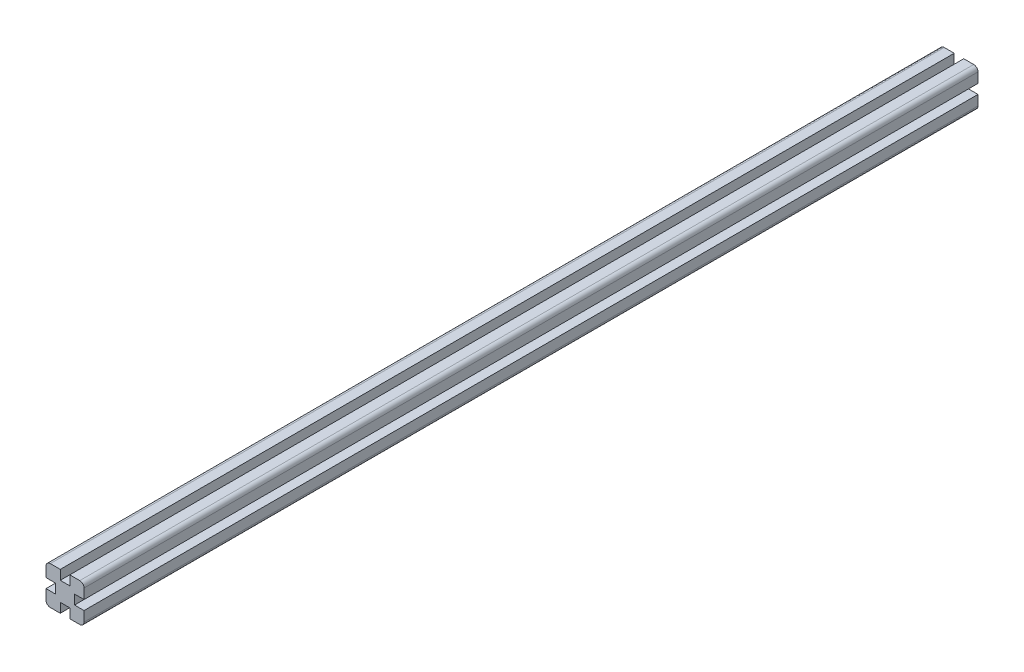
from build123d import *

# Parameters (mm, degrees)
BOSS_EXTRUDE1_DEPTH = 940


with BuildPart() as part:
    # Sketch1 → Boss-Extrude1 (new body)
    with BuildSketch(Plane.XY):
        with BuildLine():
            Line((-15.5, -20), (-5, -20))
            Line((-5, -20), (-5, -10))
            Line((-5, -10), (5, -10))
            Line((5, -10), (5, -20))
            Line((5, -20), (15.5, -20))
            ThreePointArc((15.5, -20), (18.681980515, -18.681980515), (20, -15.5))
            Line((20, -15.5), (20, -5))
            Line((20, -5), (10, -5))
            Line((10, -5), (10, 5))
            Line((10, 5), (20, 5))
            Line((20, 5), (20, 15.5))
            ThreePointArc((20, 15.5), (18.681980515, 18.681980515), (15.5, 20))
            Line((15.5, 20), (5, 20))
            Line((5, 20), (5, 10))
            Line((5, 10), (-5, 10))
            Line((-5, 10), (-5, 20))
            Line((-5, 20), (-8, 20))
            Line((-8, 20), (-15, 20))
            Line((-15, 20), (-15.5, 20))
            ThreePointArc((-15.5, 20), (-18.681980515, 18.681980515), (-20, 15.5))
            Line((-20, 15.5), (-20, 5))
            Line((-20, 5), (-10, 5))
            Line((-10, 5), (-10, -5))
            Line((-10, -5), (-20, -5))
            Line((-20, -5), (-20, -15.5))
            ThreePointArc((-20, -15.5), (-18.681980515, -18.681980515), (-15.5, -20))
        make_face()
    extrude(amount=BOSS_EXTRUDE1_DEPTH)


solid = part.part
